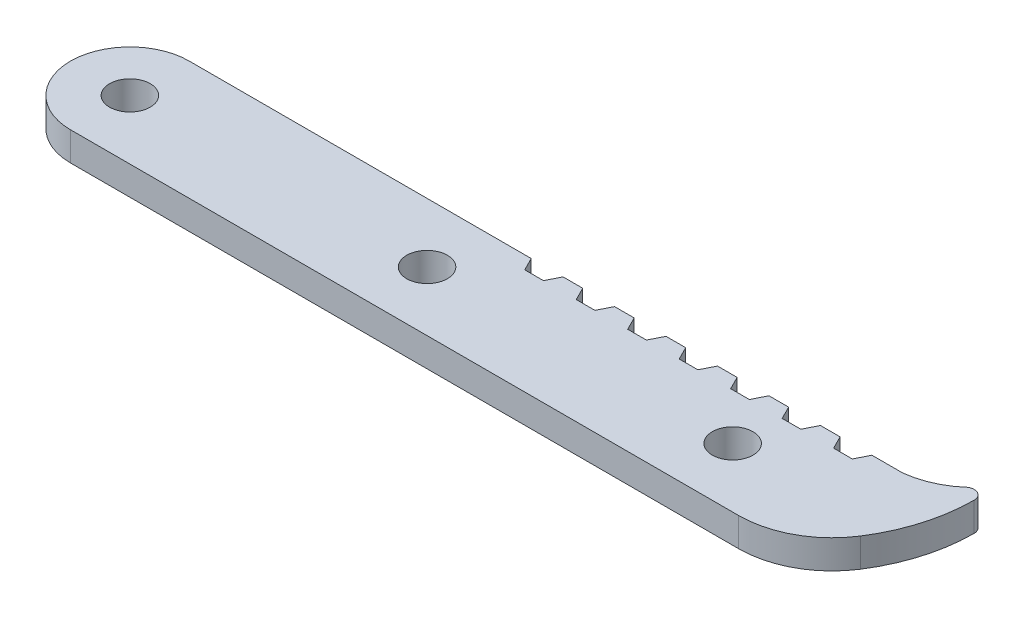
from build123d import *

# Parameters (mm, degrees)
BOSS_EXTRUDE1_DEPTH = 3.075
SKETCH2_R           = 2.175
CUT_EXTRUDE2_DEPTH  = 6.35
BOSS_EXTRUDE2_DEPTH = 3.075
CUT_EXTRUDE3_DEPTH  = 10
FILLET1_R           = 10
CUT_EXTRUDE4_DEPTH  = 10


with BuildPart() as part:
    # Sketch1 → Boss-Extrude1 (new body)
    with BuildSketch(Plane(origin=(0, 0, 0), x_dir=(1, 0, 0), z_dir=(0, 1, 0))):
        with BuildLine():
            Line((-62.844661922, 8.700177936), (13.355338078, 8.700177936))
            ThreePointArc((13.355338078, 8.700177936), (19.705338078, 2.350177936), (13.355338078, -3.999822064))
            Line((13.355338078, -3.999822064), (-62.844661922, -3.999822064))
            ThreePointArc((-62.844661922, -3.999822064), (-69.194661922, 2.350177936), (-62.844661922, 8.700177936))
        make_face()
    extrude(amount=BOSS_EXTRUDE1_DEPTH)

    # Sketch2 → Cut-Extrude2 (cut)
    with BuildSketch(Plane(origin=(0, 3.075, 0), x_dir=(1, 0, 0), z_dir=(0, 1, 0))):
        with Locations(Location((-62.844661922, 2.350177936, 0), (0, 0, 270))):
            Circle(SKETCH2_R)
        with Locations(Location((-31.094661922, 2.350177936, 0), (0, 0, 270))):
            Circle(SKETCH2_R)
        with Locations(Location((1.555338078, 2.350177936, 0), (0, 0, 270))):
            Circle(SKETCH2_R)
    extrude(amount=-CUT_EXTRUDE2_DEPTH, mode=Mode.SUBTRACT)

    # Sketch3 → Boss-Extrude2 (add)
    with BuildSketch(Plane(origin=(0, 3.075, 0), x_dir=(1, 0, 0), z_dir=(0, 1, 0))):
        with BuildLine():
            Line((13.355338078, 8.700177936), (13.355338078, 2.350177936))
            Line((13.355338078, 2.350177936), (19.705338078, 2.350177936))
            Line((19.705338078, 2.350177936), (19.705338078, 9.999403669))
            ThreePointArc((19.705338078, 9.999403669), (19.189460997, 10.874403669), (18.174088078, 10.846618776))
            ThreePointArc((18.174088078, 10.846618776), (15.930319915, 9.401611756), (13.355338078, 8.700177936))
        make_face()
    extrude(amount=-BOSS_EXTRUDE2_DEPTH)

    # Sketch4 → Cut-Extrude3 (cut)
    with BuildSketch(Plane(origin=(0, 3.075, 0), x_dir=(1, 0, 0), z_dir=(0, 1, 0))):
        with BuildLine():
            Line((19.705338078, 9.999403669), (19.705338078, -6.000596331))
            Line((19.705338078, -6.000596331), (9.205338078, -6.000596331))
            ThreePointArc((9.205338078, -6.000596331), (16.836220051, 0.436949875), (19.705338078, 9.999403669))
        make_face()
    extrude(amount=-CUT_EXTRUDE3_DEPTH, mode=Mode.SUBTRACT)

    # Fillet1
    fillet1_edges = [part.edges().sort_by_distance(p)[0] for p in [
        (12.654174153, 1.5375, 3.999822064),
    ]]
    fillet(fillet1_edges, radius=FILLET1_R)

    # Sketch5 → Cut-Extrude4 (cut)
    with BuildSketch(Plane(origin=(0, 3.075, 0), x_dir=(1, 0, 0), z_dir=(0, 1, 0))):
        Polygon((-4.314661922, 8.700177936), (-0.914661922, 8.700177936), (-1.614661922, 7.306047383), (-3.614661922, 7.306047383), align=None)
        Polygon((-9.814661922, 8.700177936), (-9.114661922, 7.306047383), (-7.114661922, 7.306047383), (-6.414661922, 8.700177936), align=None)
        Polygon((1.185338078, 8.700177936), (4.585338078, 8.700177936), (3.885338078, 7.306047383), (1.885338078, 7.306047383), align=None)
        Polygon((6.685338078, 8.700177936), (10.085338078, 8.700177936), (9.385338078, 7.306047383), (7.385338078, 7.306047383), align=None)
        Polygon((-15.314661922, 8.700177936), (-11.914661922, 8.700177936), (-12.614661922, 7.306047383), (-14.614661922, 7.306047383), align=None)
        Polygon((-20.814661922, 8.700177936), (-17.414661922, 8.700177936), (-18.114661922, 7.306047383), (-20.114661922, 7.306047383), align=None)
        Polygon((-26.314661922, 8.700177936), (-22.914661922, 8.700177936), (-23.614661922, 7.306047383), (-25.614661922, 7.306047383), align=None)
    extrude(amount=-CUT_EXTRUDE4_DEPTH, mode=Mode.SUBTRACT)


solid = part.part
